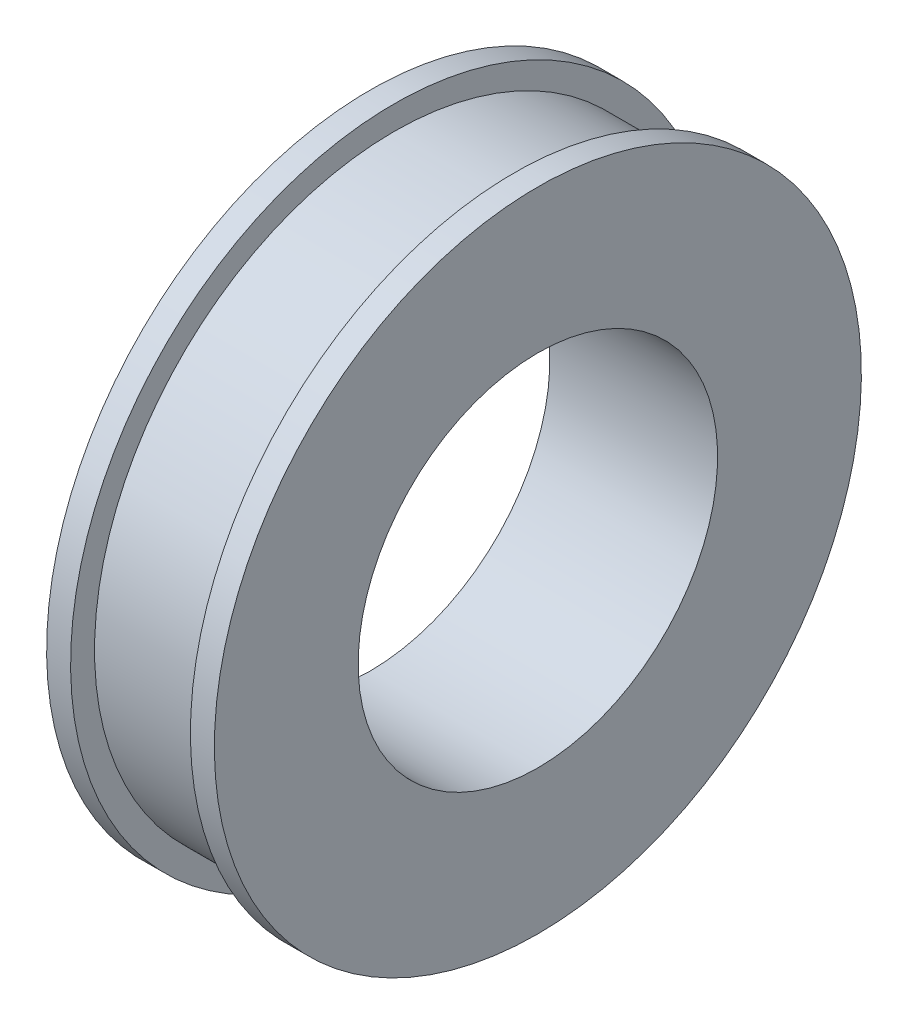
from build123d import *


with BuildPart() as part:
    # Sketch1 → Revolve1 (revolve)
    with BuildSketch(Plane.XY, mode=Mode.PRIVATE) as revolve1_sk:
        Polygon((7, 15), (7, 27), (5, 27), (5, 25), (-5, 25), (-5, 27), (-7, 27), (-7, 15), align=None)
    revolve(revolve1_sk.sketch.rotate(Axis((-7, 0, 0), (1, 0, 0)), 180), axis=Axis((-7, 0, 0), (1, 0, 0)))


solid = part.part
